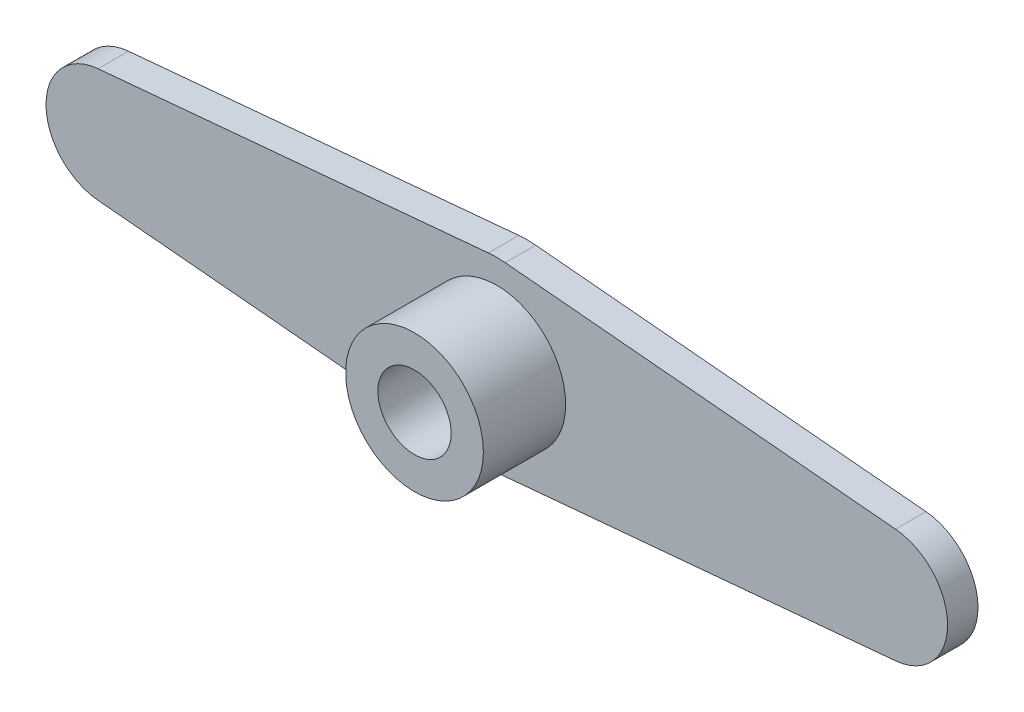
from build123d import *

# Parameters (mm, degrees)
BOSS_EXTRUDE1_DEPTH = 2.159
SKETCH2_R           = 4.8895
SKETCH2_R_2         = 2.6035
BOSS_EXTRUDE2_DEPTH = 5.842


with BuildPart() as part:
    # Sketch1 → Boss-Extrude1 (new body)
    with BuildSketch(Plane.XY):
        with BuildLine():
            Line((-28.309454545, 4.04717177), (-0.600363636, 6.576654127))
            ThreePointArc((-0.600363636, 6.576654127), (0, 6.604), (0.600363636, 6.576654127))
            Line((0.600363636, 6.576654127), (28.309454545, 4.04717177))
            ThreePointArc((28.309454545, 4.04717177), (32.004, 0), (28.309454545, -4.04717177))
            Line((28.309454545, -4.04717177), (0.600363636, -6.576654127))
            ThreePointArc((0.600363636, -6.576654127), (0, -6.604), (-0.600363636, -6.576654127))
            Line((-0.600363636, -6.576654127), (-28.309454545, -4.04717177))
            ThreePointArc((-28.309454545, -4.04717177), (-32.004, 0), (-28.309454545, 4.04717177))
        make_face()
    extrude(amount=BOSS_EXTRUDE1_DEPTH)

    # Sketch2 → Boss-Extrude2 (add)
    with BuildSketch(Plane.XY.offset(2.159)):
        Circle(SKETCH2_R)
        Circle(SKETCH2_R_2, mode=Mode.SUBTRACT)
    extrude(amount=BOSS_EXTRUDE2_DEPTH)


solid = part.part
